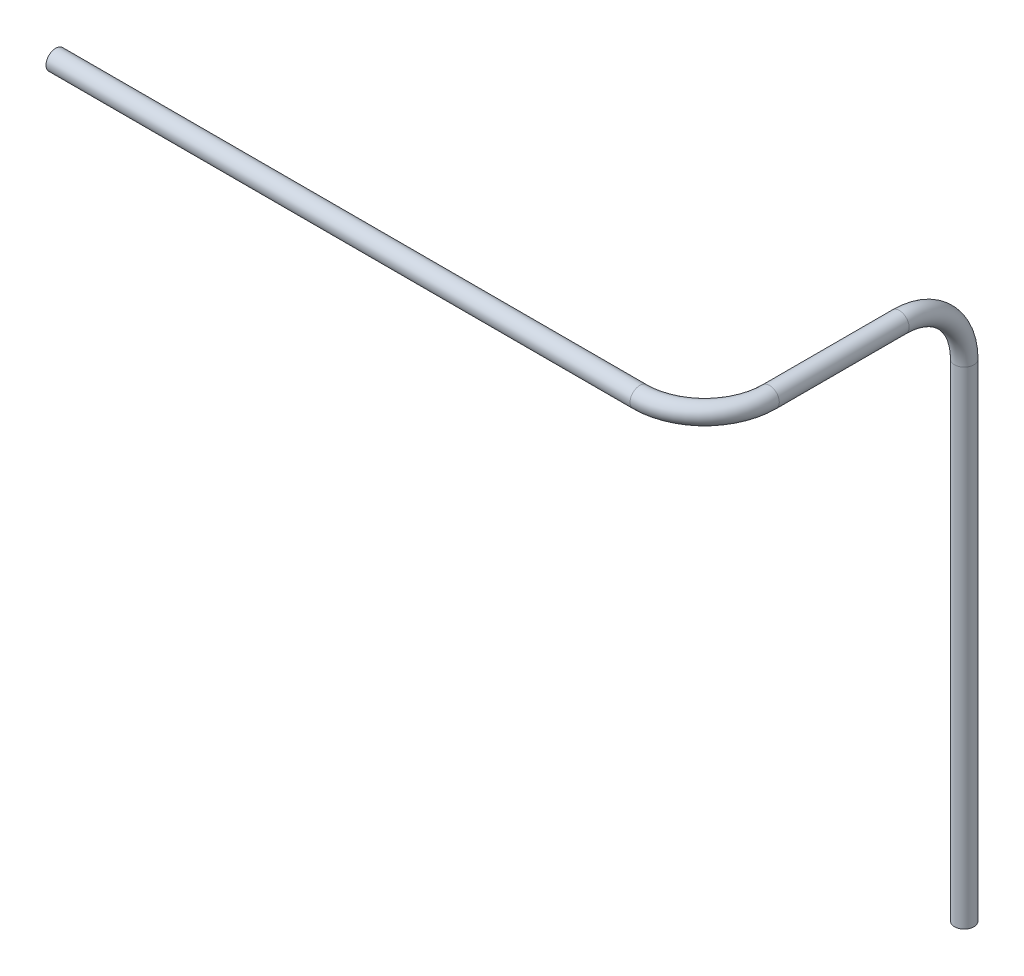
from build123d import *

# Parameters (mm, degrees)
ESQUISSE2_R   = 3
ESQUISSE2_R_2 = 2


with BuildPart() as part:
    # Balayage1: sweep along a curve in space
    with BuildLine() as balayage1_path:
        Line((0, 0, 0), (0, 150, 0))
        ThreePointArc((0, 150, 0), (0, 164.142135624, 5.857864376), (0, 170, 20))
        Line((0, 170, 20), (0, 170, 60))
        ThreePointArc((0, 170, 60), (-5.857864376, 170, 74.142135624), (-20, 170, 80))
        Line((-20, 170, 80), (-200, 170, 80))
    # Esquisse2 → Balayage1 (sweep)
    with BuildSketch(Plane(origin=(0, 0, 0), x_dir=(1, 0, 0), z_dir=(0, 1, 0))):
        Circle(ESQUISSE2_R)
        Circle(ESQUISSE2_R_2, mode=Mode.SUBTRACT)
    sweep(path=balayage1_path.line)


solid = part.part
